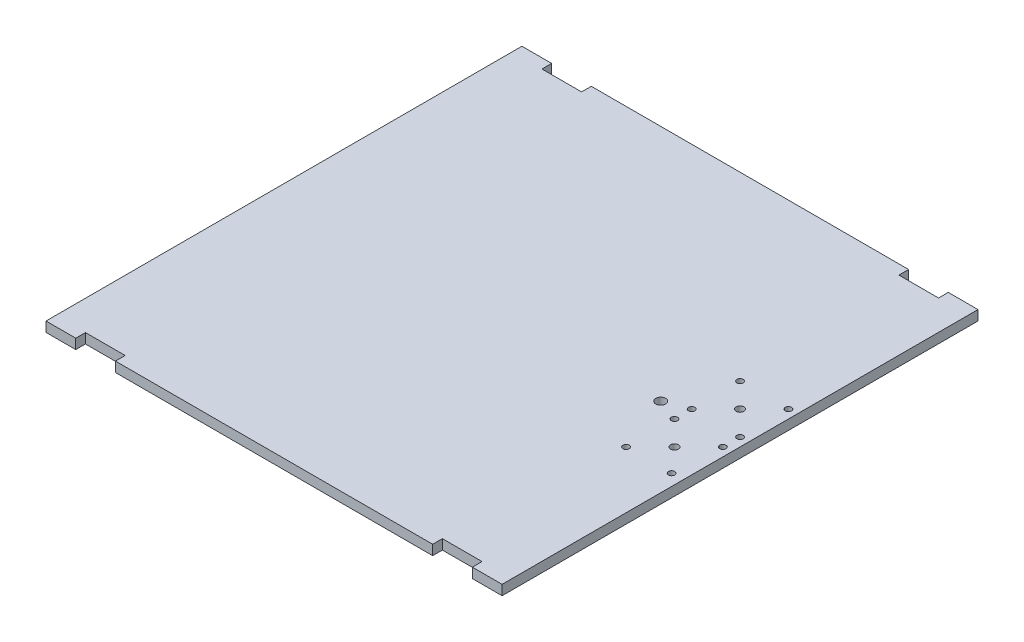
from build123d import *

# Parameters (mm, degrees)
BOSS_EXTRUDE1_DEPTH = 6.35
SKETCH4_R           = 2
SKETCH4_R_2         = 2.5
SKETCH4_R_3         = 3.175
SKETCH4_W           = 25.4
SKETCH4_H           = 6.223
CUT_EXTRUDE3_DEPTH  = 423.215315331
SKETCH5_W           = 215.9
SKETCH5_H           = 279.4
BOSS_EXTRUDE2_DEPTH = 6.35


with BuildPart() as part:
    # Sketch1 → Boss-Extrude1 (new body)
    with BuildSketch(Plane(origin=(0, 0, 0), x_dir=(1, 0, 0), z_dir=(0, 1, 0))):
        Polygon((292.1, 0), (292.1, 152.4), (228.6, 152.4), (228.6, 12.7), (12.7, 12.7), (12.7, 152.4), (0, 152.4), (0, 0), (247.65, 0), (247.65, 6.223), (273.05, 6.223), (273.05, 0), align=None)
        Polygon((228.6, 152.4), (292.1, 152.4), (292.1, 304.8), (273.05, 304.8), (273.05, 298.577), (247.65, 298.577), (247.65, 304.8), (0, 304.8), (0, 152.4), (12.7, 152.4), (12.7, 292.1), (228.6, 292.1), align=None)
    extrude(amount=BOSS_EXTRUDE1_DEPTH)

    # Sketch4 → Cut-Extrude3 (cut, through all)
    with BuildSketch(Plane(origin=(0, 6.35, 0), x_dir=(1, 0, 0), z_dir=(0, 1, 0))):
        with Locations(Location((286.6, 188.9, 0), (0, 0, 270))):
            Circle(SKETCH4_R)
        with Locations(Location((286.6, 157.9, 0), (0, 0, 270))):
            Circle(SKETCH4_R)
        with Locations(Location((255.6, 157.9, 0), (0, 0, 270))):
            Circle(SKETCH4_R)
        with Locations(Location((255.6, 188.9, 0), (0, 0, 270))):
            Circle(SKETCH4_R)
        with Locations(Location((255.6, 146.9, 0), (0, 0, 270))):
            Circle(SKETCH4_R)
        with Locations(Location((286.6, 146.9, 0), (0, 0, 270))):
            Circle(SKETCH4_R)
        with Locations(Location((284.763488048, 115.9, 0), (0, 0, 270))):
            Circle(SKETCH4_R)
        with Locations(Location((255.6, 115.9, 0), (0, 0, 270))):
            Circle(SKETCH4_R)
        with Locations(Location((271.1, 173.4, 0), (0, 0, 270))):
            Circle(SKETCH4_R_2)
        with Locations(Location((271.1, 131.4, 0), (0, 0, 270))):
            Circle(SKETCH4_R_2)
        with Locations(Location((241.3, 152.4, 0), (0, 0, 270))):
            Circle(SKETCH4_R_3)
        with Locations((260.35, 301.6885)):
            Rectangle(SKETCH4_W, SKETCH4_H)
        with Locations((260.35, 3.1115)):
            Rectangle(SKETCH4_W, SKETCH4_H)
        with Locations((31.75, 3.1115)):
            Rectangle(SKETCH4_W, SKETCH4_H)
        with Locations((31.75, 301.6885)):
            Rectangle(SKETCH4_W, SKETCH4_H)
    extrude(amount=-CUT_EXTRUDE3_DEPTH, mode=Mode.SUBTRACT)

    # Sketch5 → Boss-Extrude2 (add)
    with BuildSketch(Plane(origin=(0, 6.35, 0), x_dir=(1, 0, 0), z_dir=(0, 1, 0))):
        with Locations((120.65, 152.4)):
            Rectangle(SKETCH5_W, SKETCH5_H)
    extrude(amount=-BOSS_EXTRUDE2_DEPTH)


solid = part.part
